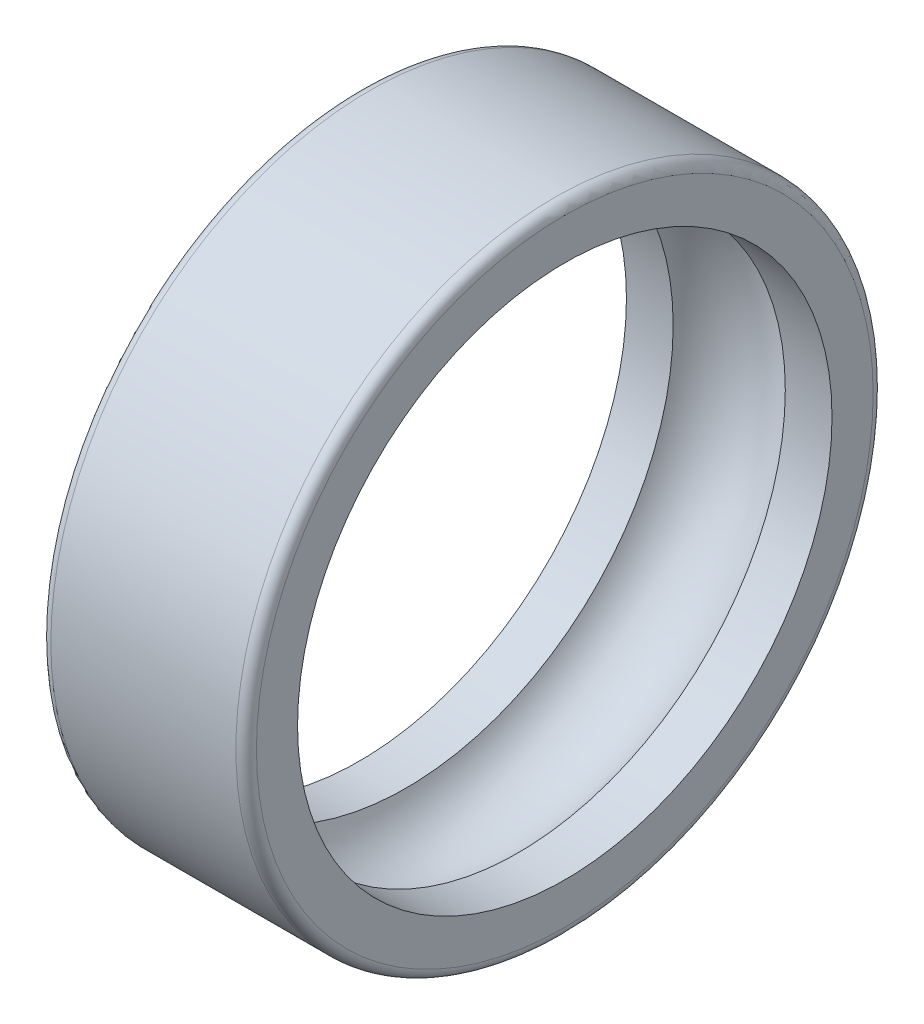
from build123d import *

# Parameters (mm, degrees)
FILLET1_R = 1


with BuildPart() as part:
    # Sketch1 → Revolve1 (revolve)
    with BuildSketch(Plane.XY, mode=Mode.PRIVATE) as revolve1_sk:
        with BuildLine():
            Line((10, 31), (-10, 31))
            Line((-10, 31), (-10, 26))
            Line((-10, 26), (-5.454356057, 26))
            ThreePointArc((-5.454356057, 26), (0, 29.5), (5.454356057, 26))
            Line((5.454356057, 26), (10, 26))
            Line((10, 26), (10, 31))
        make_face()
    revolve(revolve1_sk.sketch.rotate(Axis((30.309278351, 0, 0), (-1, 0, 0)), 90), axis=Axis((30.309278351, 0, 0), (-1, 0, 0)))

    # Fillet1
    fillet1_edges = [part.edges().sort_by_distance(p)[0] for p in [
        (10, 0, 31),
        (-10, 0, 31),
    ]]
    fillet(fillet1_edges, radius=FILLET1_R)


solid = part.part
